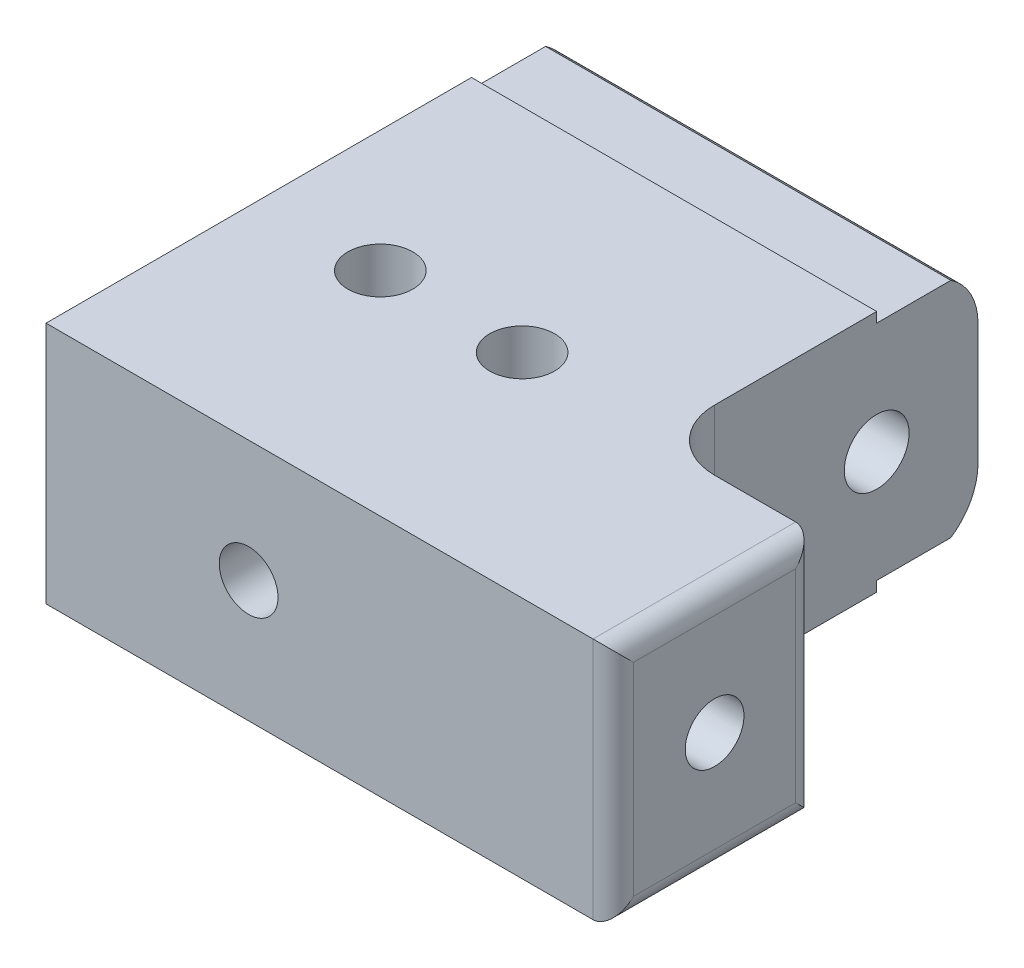
from build123d import *

# Parameters (mm, degrees)
SKETCH1_W           = 20
SKETCH1_H           = 12
BOSS_EXTRUDE1_DEPTH = 26
SKETCH2_W           = 10
SKETCH2_H           = 12
BOSS_EXTRUDE2_DEPTH = 8
SKETCH3_R           = 1.6
SKETCH3_R_2         = 1.45
CUT_EXTRUDE1_DEPTH  = 41.049968789
SKETCH4_R           = 1.6
CUT_EXTRUDE2_DEPTH  = 41.049968789
FILLET1_R           = 3
FILLET2_R           = 1
FILLET3_R           = 3
SKETCH5_W           = 9.976745634
SKETCH5_H           = 0.5
SKETCH5_W_2         = 12.25993895
CUT_EXTRUDE3_DEPTH  = 41.049968789
SKETCH6_W           = 5.5
SKETCH6_H           = 30.488056323
CUT_EXTRUDE4_DEPTH  = 0.8
SKETCH7_R           = 1.45
CUT_EXTRUDE5_DEPTH  = 8


with BuildPart() as part:
    # Sketch1 → Boss-Extrude1 (new body)
    with BuildSketch(Plane.XY):
        with Locations((10, -6)):
            Rectangle(SKETCH1_W, SKETCH1_H)
    extrude(amount=BOSS_EXTRUDE1_DEPTH)

    # Sketch2 → Boss-Extrude2 (add)
    with BuildSketch(Plane(origin=(20, 0, 0), x_dir=(0, 0, -1), z_dir=(1, 0, 0))):
        with Locations((-21, -6)):
            Rectangle(SKETCH2_W, SKETCH2_H)
    extrude(amount=BOSS_EXTRUDE2_DEPTH)

    # Sketch3 → Cut-Extrude1 (cut, through all)
    with BuildSketch(Plane.ZY):
        with Locations(Location((5, -6, 0), (0, 0, 270))):
            Circle(SKETCH3_R)
        with Locations(Location((21, -6, 0), (0, 0, 270))):
            Circle(SKETCH3_R_2)
    extrude(amount=-CUT_EXTRUDE1_DEPTH, mode=Mode.SUBTRACT)

    # Sketch4 → Cut-Extrude2 (cut, through all)
    with BuildSketch(Plane(origin=(0, 0, 0), x_dir=(1, 0, 0), z_dir=(0, 1, 0))):
        with Locations(Location((13, -15.5, 0), (0, 0, 270))):
            Circle(SKETCH4_R)
        with Locations(Location((6, -15.5, 0), (0, 0, 270))):
            Circle(SKETCH4_R)
    extrude(amount=-CUT_EXTRUDE2_DEPTH, mode=Mode.SUBTRACT)

    # Fillet1
    fillet1_edges = [part.edges().sort_by_distance(p)[0] for p in [
        (20, -6, 16),
    ]]
    fillet(fillet1_edges, radius=FILLET1_R)

    # Fillet2
    fillet2_edges = [part.edges().sort_by_distance(p)[0] for p in [
        (28, -6, 26),
        (28, -12, 21),
        (28, -6, 16),
        (28, 0, 21),
    ]]
    fillet(fillet2_edges, radius=FILLET2_R)

    # Fillet3
    fillet3_edges = [part.edges().sort_by_distance(p)[0] for p in [
        (10, 0, 0),
        (10, -12, 0),
    ]]
    fillet(fillet3_edges, radius=FILLET3_R)

    # Sketch5 → Cut-Extrude3 (cut, through all)
    with BuildSketch(Plane.ZY):
        with Locations((0.011627183, -11.75)):
            Rectangle(SKETCH5_W, SKETCH5_H)
        with Locations((-1.129969475, -0.25)):
            Rectangle(SKETCH5_W_2, SKETCH5_H)
    extrude(amount=-CUT_EXTRUDE3_DEPTH, mode=Mode.SUBTRACT)

    # Sketch6 → Cut-Extrude4 (cut)
    with BuildSketch(Plane(origin=(0, 0, 0), x_dir=(-1, 0, 0), z_dir=(0, 0, -1))):
        with Locations((-10, -7.868232937)):
            Rectangle(SKETCH6_W, SKETCH6_H)
    extrude(amount=-CUT_EXTRUDE4_DEPTH, mode=Mode.SUBTRACT)

    # Sketch7 → Cut-Extrude5 (cut)
    with BuildSketch(Plane.XY.offset(26)):
        with Locations((10, -6)):
            Circle(SKETCH7_R)
    extrude(amount=-CUT_EXTRUDE5_DEPTH, mode=Mode.SUBTRACT)


solid = part.part
